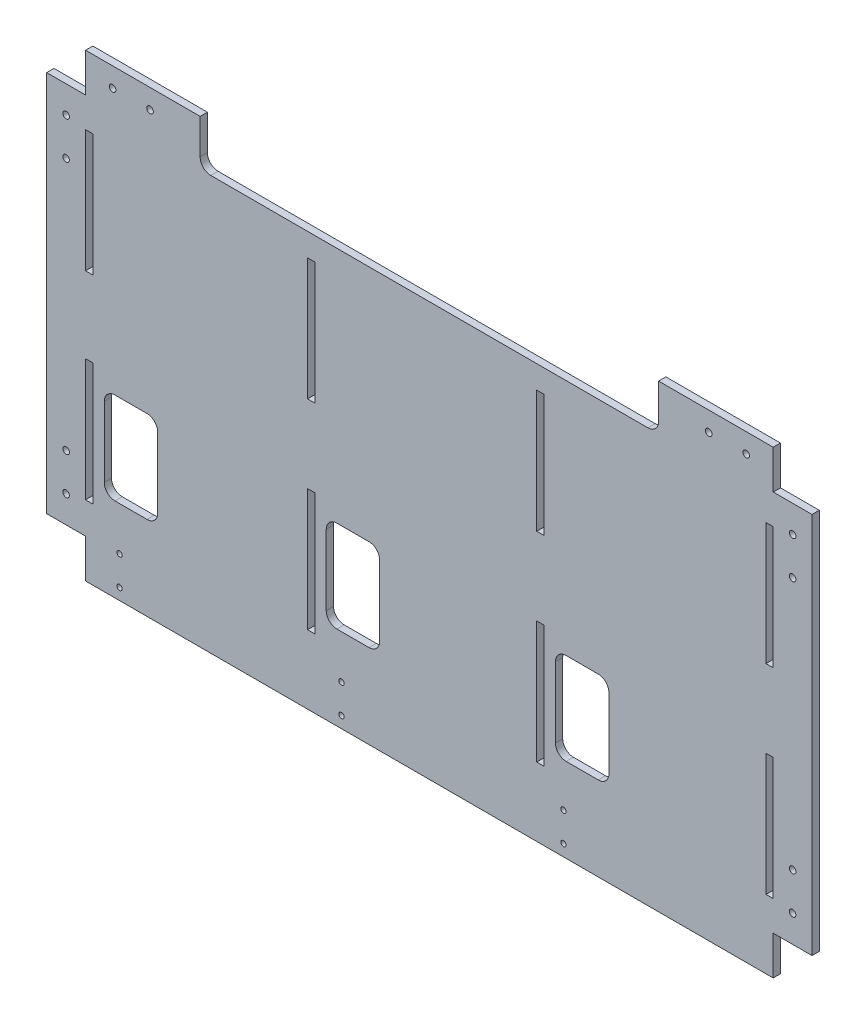
from build123d import *

# Parameters (mm, degrees)
SKETCH_1_W          = 500.8
SKETCH_1_H          = 300.8
EXTRUDE_1_DEPTH     = 4.75
SKETCH_2_W          = 25.4
SKETCH_2_H          = 25.4
SKETCH_2_W_2        = 4.75
SKETCH_2_H_2        = 80
CUT_EXTRUDE_1_DEPTH = 25.4
SKETCH_3_R          = 2.15
SKETCH_3_R_2        = 2.150000004
CUT_EXTRUDE_2_DEPTH = 5
SKETCH_5_W          = 35
SKETCH_5_H          = 60
SKETCH_5_W_2        = 300
SKETCH_5_H_2        = 30
CUT_EXTRUDE_3_DEPTH = 10
FILLET_1_R          = 7
SKETCH_6_R          = 1.75
CUT_EXTRUDE_4_DEPTH = 10


with BuildPart() as part:
    # 草圖1 → 填料-伸長1 (new body)
    with BuildSketch(Plane.XY):
        Rectangle(SKETCH_1_W, SKETCH_1_H)
    extrude(amount=EXTRUDE_1_DEPTH)

    # 草圖2 → 除料-伸長1 (cut)
    with BuildSketch(Plane(origin=(0, 0, 0), x_dir=(-1, 0, 0), z_dir=(0, 0, -1))):
        with Locations((-237.7, 137.7)):
            Rectangle(SKETCH_2_W, SKETCH_2_H)
        with Locations((-237.7, -137.7)):
            Rectangle(SKETCH_2_W, SKETCH_2_H)
        with Locations((237.7, 137.7)):
            Rectangle(SKETCH_2_W, SKETCH_2_H)
        with Locations((237.7, -137.7)):
            Rectangle(SKETCH_2_W, SKETCH_2_H)
        with Locations((-222.625, 65.4)):
            Rectangle(SKETCH_2_W_2, SKETCH_2_H_2)
        with Locations((-222.625, -65.4)):
            Rectangle(SKETCH_2_W_2, SKETCH_2_H_2)
        with Locations((222.625, 65.4)):
            Rectangle(SKETCH_2_W_2, SKETCH_2_H_2)
        with Locations((222.625, -64.4)):
            Rectangle(SKETCH_2_W_2, SKETCH_2_H_2)
        with Locations((-72.625, 65.4)):
            Rectangle(SKETCH_2_W_2, SKETCH_2_H_2)
        with Locations((77.375, 65.4)):
            Rectangle(SKETCH_2_W_2, SKETCH_2_H_2)
        with Locations((77.375, -65.4)):
            Rectangle(SKETCH_2_W_2, SKETCH_2_H_2)
        with Locations((-72.625, -65.4)):
            Rectangle(SKETCH_2_W_2, SKETCH_2_H_2)
    extrude(amount=-CUT_EXTRUDE_1_DEPTH, mode=Mode.SUBTRACT)

    # 草圖3 → 除料-伸長2 (cut)
    with BuildSketch(Plane.XY.offset(4.75)):
        with Locations((-207.3, 137.7)):
            Circle(SKETCH_3_R)
        with Locations((-182.8, 137.7)):
            Circle(SKETCH_3_R)
        with Locations((182.8, 137.7)):
            Circle(SKETCH_3_R)
        with Locations((207.3, 137.7)):
            Circle(SKETCH_3_R)
        with Locations((237.7, 107.3)):
            Circle(SKETCH_3_R)
        with Locations((237.7, 82.8)):
            Circle(SKETCH_3_R)
        with Locations((237.7, -82.800000014)):
            Circle(SKETCH_3_R_2)
        with Locations((237.7, -107.300000014)):
            Circle(SKETCH_3_R_2)
        with Locations((-237.7, 107.3)):
            Circle(SKETCH_3_R)
        with Locations((-237.7, 82.8)):
            Circle(SKETCH_3_R)
        with Locations((-237.7, -82.800000014)):
            Circle(SKETCH_3_R_2)
        with Locations((-237.7, -107.300000014)):
            Circle(SKETCH_3_R_2)
    extrude(amount=-CUT_EXTRUDE_2_DEPTH, mode=Mode.SUBTRACT)

    # 草圖5 → 除料-伸長3 (cut)
    with BuildSketch(Plane.XY.offset(4.75)):
        with Locations((100, -65.4)):
            Rectangle(SKETCH_5_W, SKETCH_5_H)
        with Locations((-50, -65.4)):
            Rectangle(SKETCH_5_W, SKETCH_5_H)
        with Locations((-195.25, -65.4)):
            Rectangle(SKETCH_5_W, SKETCH_5_H)
        with Locations((0, 135.4)):
            Rectangle(SKETCH_5_W_2, SKETCH_5_H_2)
    extrude(amount=-CUT_EXTRUDE_3_DEPTH, mode=Mode.SUBTRACT)

    # 圓角1
    fillet_1_edges = [part.edges().sort_by_distance(p)[0] for p in [
        (-150, 120.4, 2.375),
        (150, 120.4, 2.375),
        (-177.75, -35.4, 2.375),
        (-177.75, -95.4, 2.375),
        (-212.75, -95.4, 2.375),
        (-212.75, -35.4, 2.375),
        (-32.5, -35.4, 2.375),
        (-32.5, -95.4, 2.375),
        (-67.5, -95.4, 2.375),
        (-67.5, -35.4, 2.375),
        (117.5, -35.4, 2.375),
        (117.5, -95.4, 2.375),
        (82.5, -95.4, 2.375),
        (82.5, -35.4, 2.375),
    ]]
    fillet(fillet_1_edges, radius=FILLET_1_R)

    # 草圖6 → 除料-伸長4 (cut)
    with BuildSketch(Plane.XY.offset(4.75)):
        with Locations((-202.75, -142.9)):
            Circle(SKETCH_6_R)
        with Locations((-202.75, -123.9)):
            Circle(SKETCH_6_R)
        with Locations((-57.5, -142.9)):
            Circle(SKETCH_6_R)
        with Locations((-57.5, -123.9)):
            Circle(SKETCH_6_R)
        with Locations((87.75, -142.9)):
            Circle(SKETCH_6_R)
        with Locations((87.75, -123.9)):
            Circle(SKETCH_6_R)
    extrude(amount=-CUT_EXTRUDE_4_DEPTH, mode=Mode.SUBTRACT)


solid = part.part
